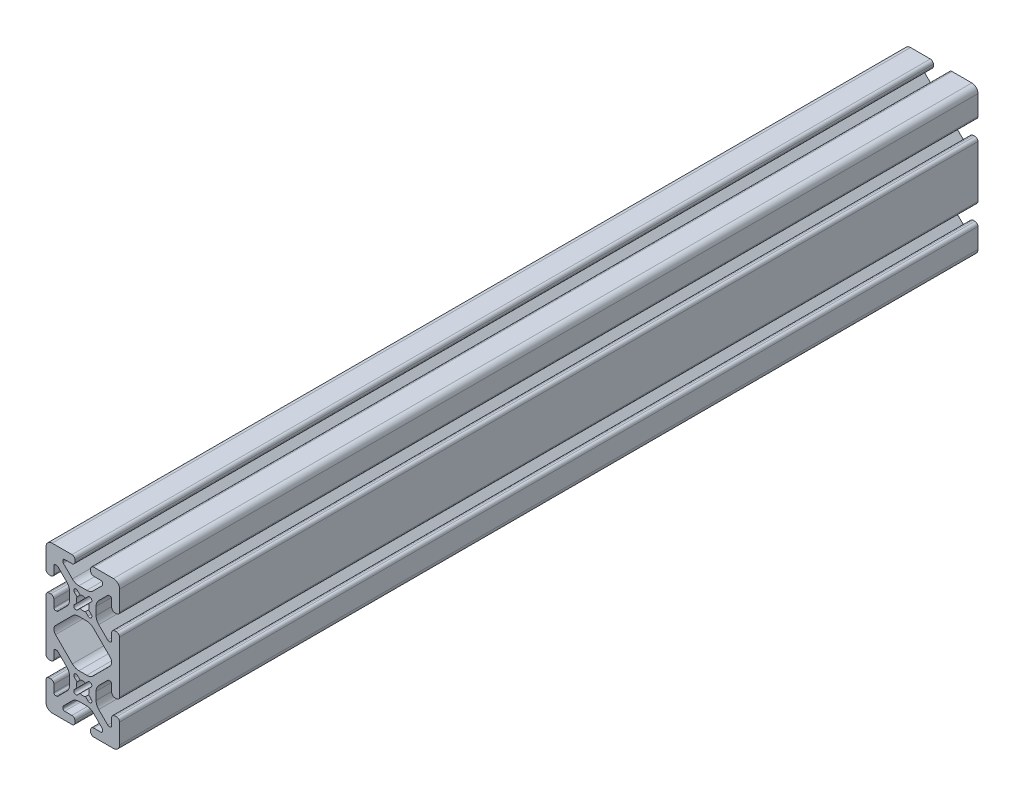
from build123d import *

# Parameters (mm, degrees)
BOSS_EXTRUDE1_DEPTH = 444.5


with BuildPart() as part:
    # Sketch1 → Boss-Extrude1 (new body)
    with BuildSketch(Plane(origin=(0, 0, -25.4), x_dir=(-1, 0, 0), z_dir=(0, 0, -1))):
        with BuildLine():
            Line((17.4752, 34.036), (16.5608, 34.036))
            ThreePointArc((16.5608, 34.036), (15.447248241, 33.574751759), (14.986, 32.4612))
            Line((14.986, 32.4612), (14.986, 28.702))
            ThreePointArc((14.986, 28.702), (14.725617928, 28.073382072), (14.097, 27.813))
            Line((14.097, 27.813), (13.528917816, 27.813))
            ThreePointArc((13.528917816, 27.813), (13.188712244, 27.880671096), (12.900299887, 28.073382072))
            Line((12.900299887, 28.073382072), (8.260840398, 32.712841561))
            ThreePointArc((8.260840398, 32.712841561), (7.231213183, 34.253787583), (6.869656187, 36.07145735))
            Line((6.869656187, 36.07145735), (6.869656187, 40.12854265))
            ThreePointArc((6.869656187, 40.12854265), (7.231213183, 41.946212417), (8.260840398, 43.487158439))
            Line((8.260840398, 43.487158439), (12.900299887, 48.126617928))
            ThreePointArc((12.900299887, 48.126617928), (13.188712244, 48.319328904), (13.528917816, 48.387))
            Line((13.528917816, 48.387), (14.097, 48.387))
            ThreePointArc((14.097, 48.387), (14.725617928, 48.126617928), (14.986, 47.498))
            Line((14.986, 47.498), (14.986, 43.7388))
            ThreePointArc((14.986, 43.7388), (15.447248241, 42.625248241), (16.5608, 42.164))
            Line((16.5608, 42.164), (17.4752, 42.164))
            ThreePointArc((17.4752, 42.164), (18.588751759, 42.625248241), (19.05, 43.7388))
            Line((19.05, 43.7388), (19.05, 53.975))
            ThreePointArc((19.05, 53.975), (18.12006403, 56.22006403), (15.875, 57.15))
            Line((15.875, 57.15), (5.6388, 57.15))
            ThreePointArc((5.6388, 57.15), (4.525248241, 56.688751759), (4.064, 55.5752))
            Line((4.064, 55.5752), (4.064, 54.6608))
            ThreePointArc((4.064, 54.6608), (4.525248241, 53.547248241), (5.6388, 53.086))
            Line((5.6388, 53.086), (9.398, 53.086))
            ThreePointArc((9.398, 53.086), (10.026617928, 52.825617928), (10.287, 52.197))
            Line((10.287, 52.197), (10.287, 51.628917816))
            ThreePointArc((10.287, 51.628917816), (10.219328904, 51.288712244), (10.026617928, 51.000299887))
            Line((10.026617928, 51.000299887), (5.387158439, 46.360840398))
            ThreePointArc((5.387158439, 46.360840398), (3.846212417, 45.331213183), (2.02854265, 44.969656187))
            Line((2.02854265, 44.969656187), (-2.02854265, 44.969656187))
            ThreePointArc((-2.02854265, 44.969656187), (-3.846212417, 45.331213183), (-5.387158439, 46.360840398))
            Line((-5.387158439, 46.360840398), (-10.026617928, 51.000299887))
            ThreePointArc((-10.026617928, 51.000299887), (-10.219328904, 51.288712244), (-10.287, 51.628917816))
            Line((-10.287, 51.628917816), (-10.287, 52.197))
            ThreePointArc((-10.287, 52.197), (-10.026617928, 52.825617928), (-9.398, 53.086))
            Line((-9.398, 53.086), (-5.6388, 53.086))
            ThreePointArc((-5.6388, 53.086), (-4.525248241, 53.547248241), (-4.064, 54.6608))
            Line((-4.064, 54.6608), (-4.064, 55.5752))
            ThreePointArc((-4.064, 55.5752), (-4.525248241, 56.688751759), (-5.6388, 57.15))
            Line((-5.6388, 57.15), (-15.875, 57.15))
            ThreePointArc((-15.875, 57.15), (-18.12006403, 56.22006403), (-19.05, 53.975))
            Line((-19.05, 53.975), (-19.05, 43.7388))
            ThreePointArc((-19.05, 43.7388), (-18.588751759, 42.625248241), (-17.4752, 42.164))
            Line((-17.4752, 42.164), (-16.5608, 42.164))
            ThreePointArc((-16.5608, 42.164), (-15.447248241, 42.625248241), (-14.986, 43.7388))
            Line((-14.986, 43.7388), (-14.986, 47.498))
            ThreePointArc((-14.986, 47.498), (-14.725617928, 48.126617928), (-14.097, 48.387))
            Line((-14.097, 48.387), (-13.528917816, 48.387))
            ThreePointArc((-13.528917816, 48.387), (-13.188712244, 48.319328904), (-12.900299887, 48.126617928))
            Line((-12.900299887, 48.126617928), (-8.260840398, 43.487158439))
            ThreePointArc((-8.260840398, 43.487158439), (-7.231213183, 41.946212417), (-6.869656187, 40.12854265))
            Line((-6.869656187, 40.12854265), (-6.869656187, 36.07145735))
            ThreePointArc((-6.869656187, 36.07145735), (-7.231213183, 34.253787583), (-8.260840398, 32.712841561))
            Line((-8.260840398, 32.712841561), (-12.900299887, 28.073382072))
            ThreePointArc((-12.900299887, 28.073382072), (-13.188712244, 27.880671096), (-13.528917816, 27.813))
            Line((-13.528917816, 27.813), (-14.097, 27.813))
            ThreePointArc((-14.097, 27.813), (-14.725617928, 28.073382072), (-14.986, 28.702))
            Line((-14.986, 28.702), (-14.986, 32.4612))
            ThreePointArc((-14.986, 32.4612), (-15.447248241, 33.574751759), (-16.5608, 34.036))
            Line((-16.5608, 34.036), (-17.4752, 34.036))
            ThreePointArc((-17.4752, 34.036), (-18.588751759, 33.574751759), (-19.05, 32.4612))
            Line((-19.05, 32.4612), (-19.05, 5.6388))
            ThreePointArc((-19.05, 5.6388), (-18.588751759, 4.525248241), (-17.4752, 4.064))
            Line((-17.4752, 4.064), (-16.5608, 4.064))
            ThreePointArc((-16.5608, 4.064), (-15.447248241, 4.525248241), (-14.986, 5.6388))
            Line((-14.986, 5.6388), (-14.986, 9.398))
            ThreePointArc((-14.986, 9.398), (-14.725617928, 10.026617928), (-14.097, 10.287))
            Line((-14.097, 10.287), (-13.528917816, 10.287))
            ThreePointArc((-13.528917816, 10.287), (-13.188712244, 10.219328904), (-12.900299887, 10.026617928))
            Line((-12.900299887, 10.026617928), (-8.260840398, 5.387158439))
            ThreePointArc((-8.260840398, 5.387158439), (-7.231213183, 3.846212417), (-6.869656187, 2.02854265))
            Line((-6.869656187, 2.02854265), (-6.869656187, -2.02854265))
            ThreePointArc((-6.869656187, -2.02854265), (-7.231213183, -3.846212417), (-8.260840398, -5.387158439))
            Line((-8.260840398, -5.387158439), (-12.900299887, -10.026617928))
            ThreePointArc((-12.900299887, -10.026617928), (-13.188712244, -10.219328904), (-13.528917816, -10.287))
            Line((-13.528917816, -10.287), (-14.097, -10.287))
            ThreePointArc((-14.097, -10.287), (-14.725617928, -10.026617928), (-14.986, -9.398))
            Line((-14.986, -9.398), (-14.986, -5.6388))
            ThreePointArc((-14.986, -5.6388), (-15.447248241, -4.525248241), (-16.5608, -4.064))
            Line((-16.5608, -4.064), (-17.4752, -4.064))
            ThreePointArc((-17.4752, -4.064), (-18.588751759, -4.525248241), (-19.05, -5.6388))
            Line((-19.05, -5.6388), (-19.05, -15.875))
            ThreePointArc((-19.05, -15.875), (-18.12006403, -18.12006403), (-15.875, -19.05))
            Line((-15.875, -19.05), (-5.6388, -19.05))
            ThreePointArc((-5.6388, -19.05), (-4.525248241, -18.588751759), (-4.064, -17.4752))
            Line((-4.064, -17.4752), (-4.064, -16.5608))
            ThreePointArc((-4.064, -16.5608), (-4.525248241, -15.447248241), (-5.6388, -14.986))
            Line((-5.6388, -14.986), (-9.398, -14.986))
            ThreePointArc((-9.398, -14.986), (-10.026617928, -14.725617928), (-10.287, -14.097))
            Line((-10.287, -14.097), (-10.287, -13.528917816))
            ThreePointArc((-10.287, -13.528917816), (-10.219328904, -13.188712244), (-10.026617928, -12.900299887))
            Line((-10.026617928, -12.900299887), (-5.387158439, -8.260840398))
            ThreePointArc((-5.387158439, -8.260840398), (-3.846212417, -7.231213183), (-2.02854265, -6.869656187))
            Line((-2.02854265, -6.869656187), (2.02854265, -6.869656187))
            ThreePointArc((2.02854265, -6.869656187), (3.846212417, -7.231213183), (5.387158439, -8.260840398))
            Line((5.387158439, -8.260840398), (10.026617928, -12.900299887))
            ThreePointArc((10.026617928, -12.900299887), (10.219328904, -13.188712244), (10.287, -13.528917816))
            Line((10.287, -13.528917816), (10.287, -14.097))
            ThreePointArc((10.287, -14.097), (10.026617928, -14.725617928), (9.398, -14.986))
            Line((9.398, -14.986), (5.6388, -14.986))
            ThreePointArc((5.6388, -14.986), (4.525248241, -15.447248241), (4.064, -16.5608))
            Line((4.064, -16.5608), (4.064, -17.4752))
            ThreePointArc((4.064, -17.4752), (4.525248241, -18.588751759), (5.6388, -19.05))
            Line((5.6388, -19.05), (15.875, -19.05))
            ThreePointArc((15.875, -19.05), (18.12006403, -18.12006403), (19.05, -15.875))
            Line((19.05, -15.875), (19.05, -5.6388))
            ThreePointArc((19.05, -5.6388), (18.588751759, -4.525248241), (17.4752, -4.064))
            Line((17.4752, -4.064), (16.5608, -4.064))
            ThreePointArc((16.5608, -4.064), (15.447248241, -4.525248241), (14.986, -5.6388))
            Line((14.986, -5.6388), (14.986, -9.398))
            ThreePointArc((14.986, -9.398), (14.725617928, -10.026617928), (14.097, -10.287))
            Line((14.097, -10.287), (13.528917816, -10.287))
            ThreePointArc((13.528917816, -10.287), (13.188712244, -10.219328904), (12.900299887, -10.026617928))
            Line((12.900299887, -10.026617928), (8.260840398, -5.387158439))
            ThreePointArc((8.260840398, -5.387158439), (7.231213183, -3.846212417), (6.869656187, -2.02854265))
            Line((6.869656187, -2.02854265), (6.869656187, 2.02854265))
            ThreePointArc((6.869656187, 2.02854265), (7.231213183, 3.846212417), (8.260840398, 5.387158439))
            Line((8.260840398, 5.387158439), (12.900299887, 10.026617928))
            ThreePointArc((12.900299887, 10.026617928), (13.188712244, 10.219328904), (13.528917816, 10.287))
            Line((13.528917816, 10.287), (14.097, 10.287))
            ThreePointArc((14.097, 10.287), (14.725617928, 10.026617928), (14.986, 9.398))
            Line((14.986, 9.398), (14.986, 5.6388))
            ThreePointArc((14.986, 5.6388), (15.447248241, 4.525248241), (16.5608, 4.064))
            Line((16.5608, 4.064), (17.4752, 4.064))
            ThreePointArc((17.4752, 4.064), (18.588751759, 4.525248241), (19.05, 5.6388))
            Line((19.05, 5.6388), (19.05, 32.4612))
            ThreePointArc((19.05, 32.4612), (18.588751759, 33.574751759), (17.4752, 34.036))
        make_face()
        with BuildLine():
            Line((5.387158439, 29.839159602), (14.110859133, 21.115458908))
            ThreePointArc((14.110859133, 21.115458908), (14.966400226, 19.05), (14.110859133, 16.984541092))
            Line((14.110859133, 16.984541092), (5.387158439, 8.260840398))
            ThreePointArc((5.387158439, 8.260840398), (3.846212417, 7.231213183), (2.02854265, 6.869656187))
            Line((2.02854265, 6.869656187), (-2.02854265, 6.869656187))
            ThreePointArc((-2.02854265, 6.869656187), (-3.846212417, 7.231213183), (-5.387158439, 8.260840398))
            Line((-5.387158439, 8.260840398), (-14.110859133, 16.984541092))
            ThreePointArc((-14.110859133, 16.984541092), (-14.966400226, 19.05), (-14.110859133, 21.115458908))
            Line((-14.110859133, 21.115458908), (-5.387158439, 29.839159602))
            ThreePointArc((-5.387158439, 29.839159602), (-3.846212417, 30.868786817), (-2.02854265, 31.230343813))
            Line((-2.02854265, 31.230343813), (2.02854265, 31.230343813))
            ThreePointArc((2.02854265, 31.230343813), (3.846212417, 30.868786817), (5.387158439, 29.839159602))
        make_face(mode=Mode.SUBTRACT)
        with BuildLine():
            Line((1.401430967, 3.017877069), (2.72685484, 4.343300942))
            ThreePointArc((2.72685484, 4.343300942), (4.343300937, 4.343300943), (4.34330094, 2.726854846))
            Line((4.34330094, 2.726854846), (3.017877069, 1.401430967))
            ThreePointArc((3.017877069, 1.401430967), (3.3274, 9e-09), (3.017877077, -1.40143095))
            Line((3.017877077, -1.40143095), (4.343300961, -2.726854828))
            ThreePointArc((4.343300961, -2.726854828), (4.343300966, -4.343300942), (2.726854852, -4.343300946))
            Line((2.726854852, -4.343300946), (1.401430967, -3.017877069))
            ThreePointArc((1.401430967, -3.017877069), (9e-09, -3.3274), (-1.40143095, -3.017877077))
            Line((-1.40143095, -3.017877077), (-2.726854834, -4.343300967))
            ThreePointArc((-2.726854834, -4.343300967), (-4.343300953, -4.343300971), (-4.343300954, -2.726854852))
            Line((-4.343300954, -2.726854852), (-3.017877069, -1.401430967))
            ThreePointArc((-3.017877069, -1.401430967), (-3.3274, -9e-09), (-3.017877077, 1.40143095))
            Line((-3.017877077, 1.40143095), (-4.343300961, 2.726854828))
            ThreePointArc((-4.343300961, 2.726854828), (-4.343300966, 4.343300942), (-2.726854852, 4.343300946))
            Line((-2.726854852, 4.343300946), (-1.401430967, 3.017877069))
            ThreePointArc((-1.401430967, 3.017877069), (0, 3.3274), (1.401430967, 3.017877069))
        make_face(mode=Mode.SUBTRACT)
        with BuildLine():
            Line((3.017877073, 36.698569024), (4.343300948, 35.373145156))
            ThreePointArc((4.343300948, 35.373145156), (4.343300954, 33.756699073), (2.726854871, 33.756699063))
            Line((2.726854871, 33.756699063), (1.401430985, 35.082122929))
            ThreePointArc((1.401430985, 35.082122929), (2.9e-08, 34.772599992), (-1.401430933, 35.082122908))
            Line((-1.401430933, 35.082122908), (-2.726854762, 33.756699066))
            ThreePointArc((-2.726854762, 33.756699066), (-4.343300901, 33.75669906), (-4.343300903, 35.373145199))
            Line((-4.343300903, 35.373145199), (-3.017877069, 36.698569033))
            ThreePointArc((-3.017877069, 36.698569033), (-3.327399996, 38.099999979), (-3.017877079, 39.501430928))
            Line((-3.017877079, 39.501430928), (-4.343300948, 40.826854777))
            ThreePointArc((-4.343300948, 40.826854777), (-4.343300957, 42.443300899), (-2.726854835, 42.443300905))
            Line((-2.726854835, 42.443300905), (-1.401430977, 41.117877054))
            ThreePointArc((-1.401430977, 41.117877054), (-8e-09, 41.427399992), (1.401430963, 41.117877065))
            Line((1.401430963, 41.117877065), (2.726854864, 42.443300966))
            ThreePointArc((2.726854864, 42.443300966), (4.343300963, 42.443300968), (4.343300969, 40.826854869))
            Line((4.343300969, 40.826854869), (3.017877073, 39.501430959))
            ThreePointArc((3.017877073, 39.501430959), (3.327400004, 38.099999992), (3.017877073, 36.698569024))
        make_face(mode=Mode.SUBTRACT)
    extrude(amount=-BOSS_EXTRUDE1_DEPTH)


solid = part.part
